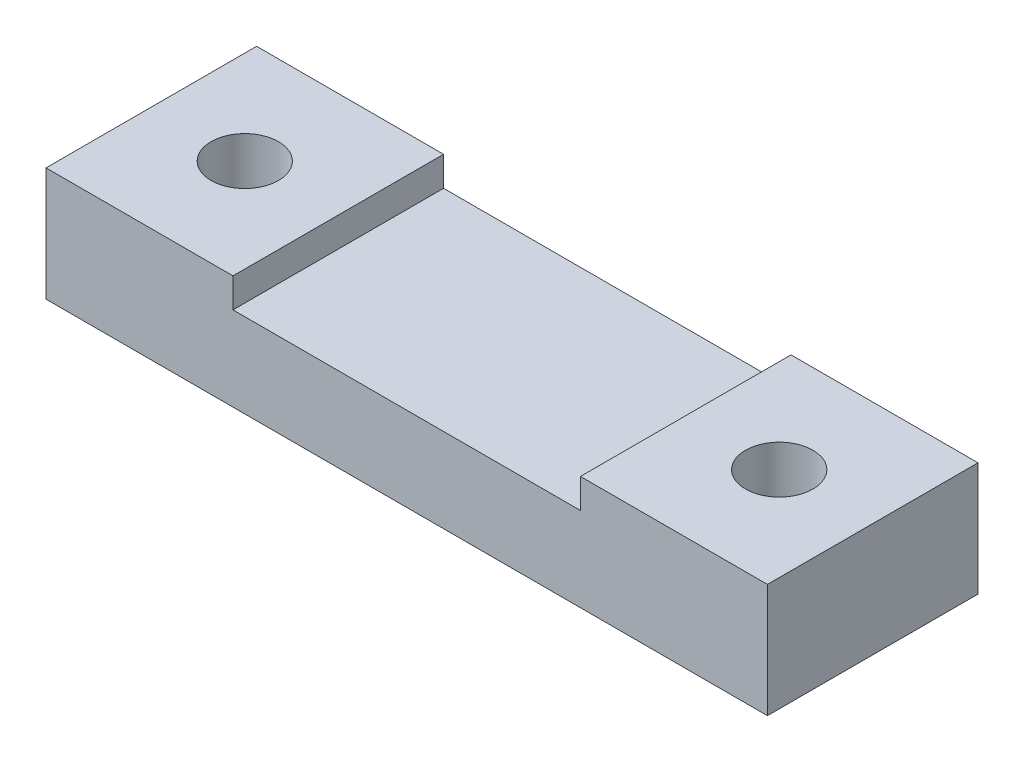
from build123d import *

# Parameters (mm, degrees)
SKETCH1_W             = 8.88
SKETCH1_H             = 10
SKETCH1_R             = 1.6
BOSS_EXTRUDE1_DEPTH   = 1.4
BOSS_EXTRUDE1_2_DEPTH = 1.4
BOSS_EXTRUDE3_START   = -4
SKETCH1_5_W           = 34.26
SKETCH1_5_H           = 10
SKETCH1_5_R           = 1.6
BOSS_EXTRUDE3_DEPTH   = 4


with BuildPart() as part:
    # Sketch1 → Boss-Extrude1 (new body)
    with BuildSketch(Plane(origin=(0, 0, 0), x_dir=(1, 0, 0), z_dir=(0, 1, 0))):
        with Locations((4.44, 5)):
            Rectangle(SKETCH1_W, SKETCH1_H)
        with Locations((4.44, 5)):
            Circle(SKETCH1_R, mode=Mode.SUBTRACT)
    extrude(amount=BOSS_EXTRUDE1_DEPTH)



with BuildPart() as body_2:
    # Sketch1 → Boss-Extrude1 2 (new body)
    with BuildSketch(Plane(origin=(0, 0, 0), x_dir=(1, 0, 0), z_dir=(0, 1, 0))):
        with Locations((29.82, 5)):
            Rectangle(SKETCH1_W, SKETCH1_H)
        with Locations((29.82, 5)):
            Circle(SKETCH1_R, mode=Mode.SUBTRACT)
    extrude(amount=BOSS_EXTRUDE1_2_DEPTH)


with BuildPart() as part_1:
    add(part.part)

    add(body_2.part)  # Boss-Extrude3 merges body 2
    # Sketch1<5> → Boss-Extrude3 (add)
    with BuildSketch(Plane(origin=(0, 0, 0), x_dir=(1, 0, 0), z_dir=(0, 1, 0)).offset(BOSS_EXTRUDE3_START)):
        with Locations((17.13, 5)):
            Rectangle(SKETCH1_5_W, SKETCH1_5_H)
        with Locations((4.44, 5)):
            Circle(SKETCH1_5_R, mode=Mode.SUBTRACT)
        with Locations((29.82, 5)):
            Circle(SKETCH1_5_R, mode=Mode.SUBTRACT)
    extrude(amount=BOSS_EXTRUDE3_DEPTH)


solid = part_1.part
